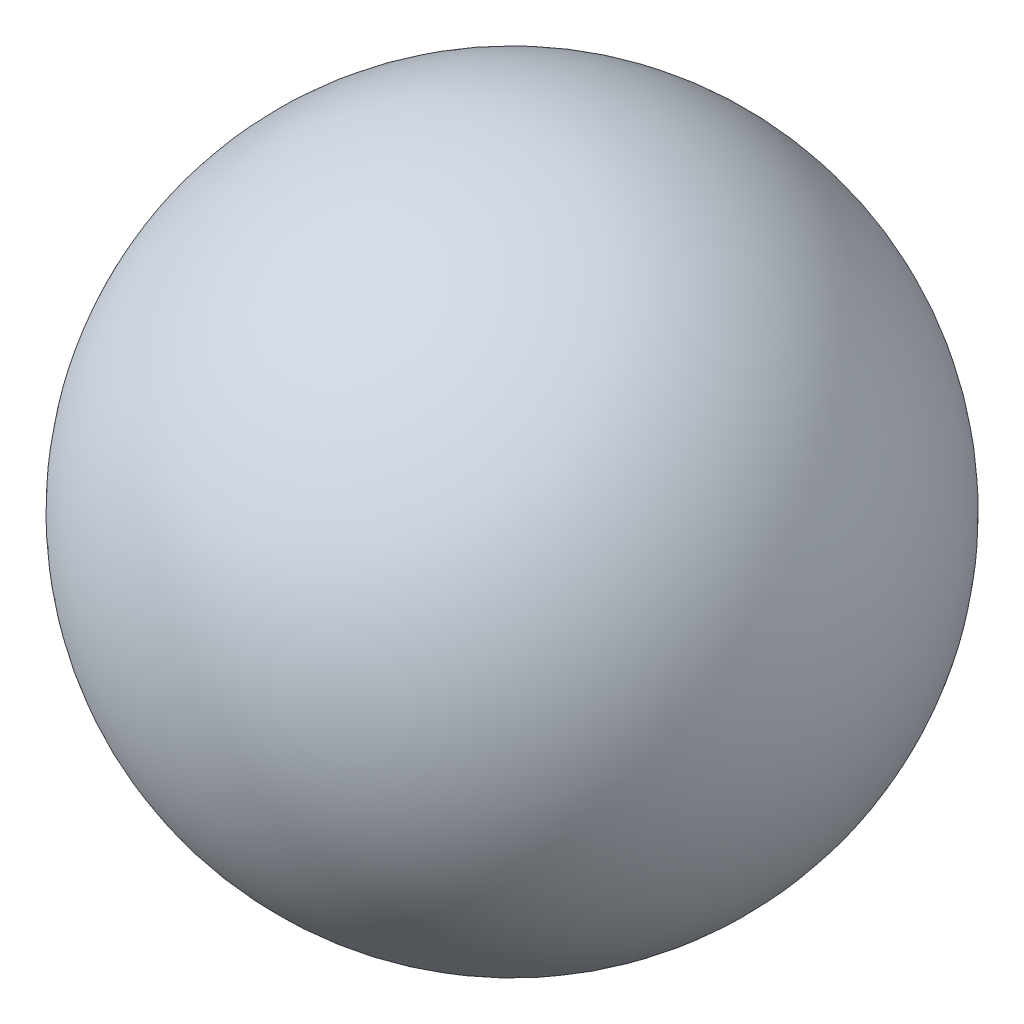
from build123d import *

# Parameters (mm, degrees)
SCALE1_SCALE = 6
SCALE2_SCALE = 3.323882225


with BuildPart() as part:
    # Sketch1 → Revolve1 (revolve)
    with BuildSketch(Plane.XY):
        with BuildLine():
            Line((0, 0), (2.2, 0))
            ThreePointArc((2.2, 0), (0, 2.2), (-2.2, 0))
            Line((-2.2, 0), (0, 0))
        make_face()
    revolve(axis=Axis((0, 0, 0), (-1, 0, 0)))


with BuildPart() as part_1:
    # Scale1: scaled about (0, 0, 0)
    add(part.part.scale(SCALE1_SCALE))


with BuildPart() as part_2:
    # Scale2: scaled about (0, 0, 0)
    add(part_1.part.scale(SCALE2_SCALE))


solid = part_2.part
